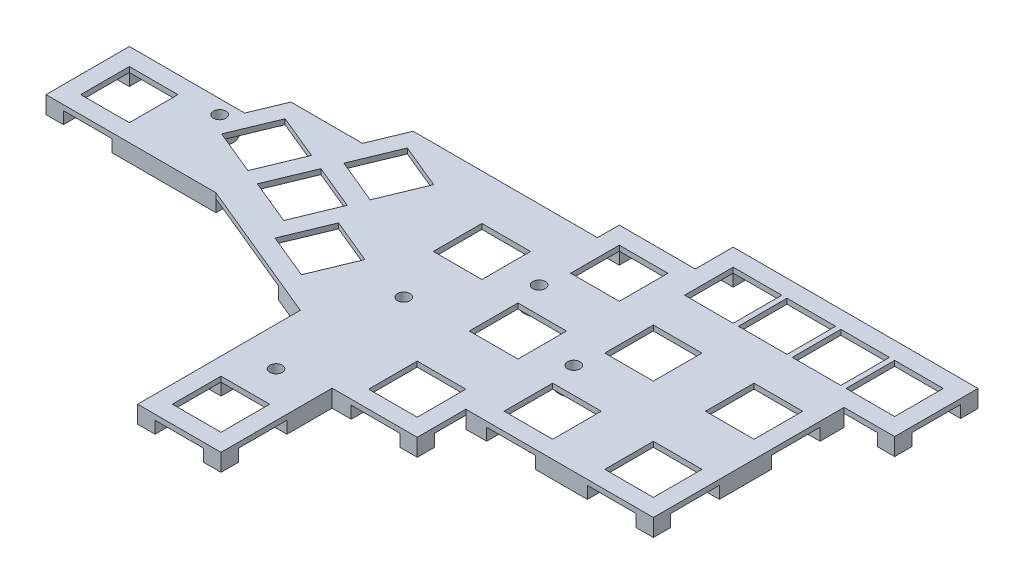
from build123d import *

# Parameters (mm, degrees)
SKETCH2_W                      = 14
SKETCH2_H                      = 14
BOSS_EXTRUDE1_DEPTH            = 1.5
SKETCH3_R                      = 7.5
SKETCH3_R_2                    = 4.250000483
SKETCH3_R_3                    = 4.259363822
SKETCH3_W                      = 5
SKETCH3_H                      = 5
SKETCH3_W_2                    = 29.940596835
SKETCH3_W_3                    = 6
SKETCH3_W_4                    = 15
SKETCH3_H_2                    = 15
SKETCH3_W_5                    = 2.885686077
SKETCH3_H_3                    = 6.92
SKETCH3_W_6                    = 48.043350903
SKETCH3_H_4                    = 3
BOSS_EXTRUDE2_DEPTH            = 3.5
M3_CLEARANCE_HOLE1_D           = 3.6
M3_CLEARANCE_HOLE1_CSINK_D     = 3.65
M3_CLEARANCE_HOLE1_CSINK_ANGLE = 90


with BuildPart() as part:
    # Sketch2 → Boss-Extrude1 (new body)
    with BuildSketch(Plane(origin=(0, 0, 0), x_dir=(1, 0, 0), z_dir=(0, 1, 0))):
        Polygon((90.5, 34), (90.5, 88.92), (105.066, 88.92), (105.066, 112.92), (34.566, 112.92), (34.566, 101.999439424), (12.680313923, 101.999439424), (12.680313923, 95.731483365), (-40.408317869, 95.731483365), (-44.678770934, 85.421697657), (-65.29834235, 85.421697657), (-69.197497471, 76.008304483), (-102.403943224, 76.008304483), (-102.403943224, 52.008304483), (-53.463346389, 52.008304483), (-12, 34.833624067), (-12, -12), (12, -12), (12, 20), (36.5, 20), (36.5, 34), align=None)
        with Locations((-90.403943224, 64.008304483)):
            Rectangle(SKETCH2_W, SKETCH2_H, mode=Mode.SUBTRACT)
        Polygon((-67.315017213, 67.487384202), (-61.95744916, 80.421697657), (-49.023135705, 75.064129604), (-54.380703758, 62.129816149), align=None, mode=Mode.SUBTRACT)
        with Locations((46.566, 100.92)):
            Rectangle(SKETCH2_W, SKETCH2_H, mode=Mode.SUBTRACT)
        Polygon((-31.423230611, 67.774010218), (-44.357544066, 73.131578271), (-49.715112119, 60.197264816), (-36.780798664, 54.839696762), align=None, mode=Mode.SUBTRACT)
        with Locations((-0.524094275, 75.65587615)):
            Rectangle(SKETCH2_W, SKETCH2_H, mode=Mode.SUBTRACT)
        with Locations((24.680313923, 89.999439424)):
            Rectangle(SKETCH2_W, SKETCH2_H, mode=Mode.SUBTRACT)
        with Locations((24.5, 61)):
            Rectangle(SKETCH2_W, SKETCH2_H, mode=Mode.SUBTRACT)
        with Locations((24.5, 32)):
            Rectangle(SKETCH2_W, SKETCH2_H, mode=Mode.SUBTRACT)
        with Locations((49.5, 46)):
            Rectangle(SKETCH2_W, SKETCH2_H, mode=Mode.SUBTRACT)
        with Locations((49.5, 75)):
            Rectangle(SKETCH2_W, SKETCH2_H, mode=Mode.SUBTRACT)
        with Locations((78.5, 75)):
            Rectangle(SKETCH2_W, SKETCH2_H, mode=Mode.SUBTRACT)
        with Locations((78.5, 46)):
            Rectangle(SKETCH2_W, SKETCH2_H, mode=Mode.SUBTRACT)
        Rectangle(SKETCH2_W, SKETCH2_H, mode=Mode.SUBTRACT)
        Polygon((-33.645940754, 49.211627299), (-20.711627299, 43.854059246), (-15.354059246, 56.788372701), (-28.288372701, 62.145940754), align=None, mode=Mode.SUBTRACT)
        Polygon((-42.424992732, 77.79716991), (-37.067424679, 90.731483365), (-24.133111224, 85.373915312), (-29.490679277, 72.439601857), align=None, mode=Mode.SUBTRACT)
        with Locations((62.066, 100.92)):
            Rectangle(SKETCH2_W, SKETCH2_H, mode=Mode.SUBTRACT)
        with Locations((77.566, 100.92)):
            Rectangle(SKETCH2_W, SKETCH2_H, mode=Mode.SUBTRACT)
        with Locations((93.066, 100.92)):
            Rectangle(SKETCH2_W, SKETCH2_H, mode=Mode.SUBTRACT)
    extrude(amount=BOSS_EXTRUDE1_DEPTH)

    # Sketch3 → Boss-Extrude2 (add)
    with BuildSketch(Plane.XZ):
        with Locations(Location((-0.403943224, -53.000000483, 0), (0, 0, 90))):
            Circle(SKETCH3_R)
        with Locations(Location((-0.903943224, -16.750000483, 0), (0, 0, 90))):
            Circle(SKETCH3_R_2)
        with Locations(Location((41.096056776, -60.500000483, 0), (0, 0, 90))):
            Circle(SKETCH3_R_3)
        with Locations(Location((16.096056776, -75.500000483, 0), (0, 0, 90))):
            Circle(SKETCH3_R_3)
        Polygon((-20.711627299, -43.854059246), (-22.625044461, -39.234661583), (-12, -34.833624067), (-12, -7), (-7, -7), (-7, -40.245585068), (-12, -40.245585068), align=None)
        with Locations((37.066, -110.42)):
            Rectangle(SKETCH3_W, SKETCH3_H)
        with Locations((102.566, -110.42)):
            Rectangle(SKETCH3_W, SKETCH3_H)
        with Locations((102.566, -91.42)):
            Rectangle(SKETCH3_W, SKETCH3_H)
        with Locations((88, -36.5)):
            Rectangle(SKETCH3_W, SKETCH3_H)
        with Locations((34, -22.5)):
            Rectangle(SKETCH3_W, SKETCH3_H)
        with Locations((9.5, 9.5)):
            Rectangle(SKETCH3_W, SKETCH3_H)
        with Locations((-9.5, 9.5)):
            Rectangle(SKETCH3_W, SKETCH3_H)
        with Locations((-99.903943224, -54.508304483)):
            Rectangle(SKETCH3_W, SKETCH3_H)
        with Locations((-99.903943224, -73.508304483)):
            Rectangle(SKETCH3_W, SKETCH3_H)
        Polygon((17.5, -25), (7, -25), (7, -7), (12, -7), (12, -20), (17.5, -20), align=None)
        with Locations((-68.433644806, -54.508304483)):
            Rectangle(SKETCH3_W_2, SKETCH3_H)
        with Locations((15.180313923, -99.499439424)):
            Rectangle(SKETCH3_W, SKETCH3_H)
        with BuildLine():
            Line((-83.403943224, -71.008304483), (-76.205169586, -71.008304483))
            ThreePointArc((-76.205169586, -71.008304483), (-70.746354877, -68.438373932), (-69.197497471, -74.269689546))
            Line((-69.197497471, -74.269689546), (-69.197497471, -76.008304483))
            Line((-69.197497471, -76.008304483), (-83.403943224, -76.008304483))
            Line((-83.403943224, -76.008304483), (-83.403943224, -71.008304483))
        make_face()
        with Locations((39.5, -36.5)):
            Rectangle(SKETCH3_W_3, SKETCH3_H)
        with Locations((64, -36.5)):
            Rectangle(SKETCH3_W_4, SKETCH3_H)
        with Locations((88, -60.5)):
            Rectangle(SKETCH3_W, SKETCH3_H_2)
        with Locations((33.123156962, -99.499439424)):
            Rectangle(SKETCH3_W_5, SKETCH3_H)
        with Locations((88, -85.46)):
            Rectangle(SKETCH3_W, SKETCH3_H_3)
        with Locations((-11.341361529, -94.231483365)):
            Rectangle(SKETCH3_W_6, SKETCH3_H_4)
    extrude(amount=BOSS_EXTRUDE2_DEPTH)

    # M3 Clearance Hole1 (through all)
    with Locations(Plane(origin=(-0.403943224, -3.5, -53.000000483), x_dir=(0, 0, -1), z_dir=(0, -1, 0))):
        with Locations((0, 0), (7.5, 41.5), (22.5, 16.5), (-36.25, -0.5), (19, -72)):
            CounterSinkHole(M3_CLEARANCE_HOLE1_D / 2, M3_CLEARANCE_HOLE1_CSINK_D / 2, counter_sink_angle=M3_CLEARANCE_HOLE1_CSINK_ANGLE)


solid = part.part
